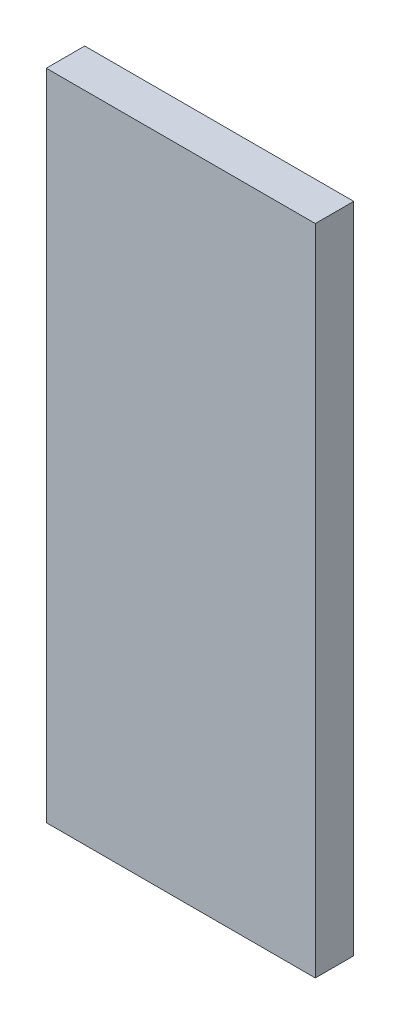
from build123d import *

# Parameters (mm, degrees)
SKETCH1_W            = 350
SKETCH1_H            = 850
REFERENCE_ONLY_DEPTH = 50


with BuildPart() as part:
    # Sketch1 → Reference_only (new body)
    with BuildSketch(Plane.XY):
        with Locations((175, 425)):
            Rectangle(SKETCH1_W, SKETCH1_H)
    extrude(amount=REFERENCE_ONLY_DEPTH)


solid = part.part
